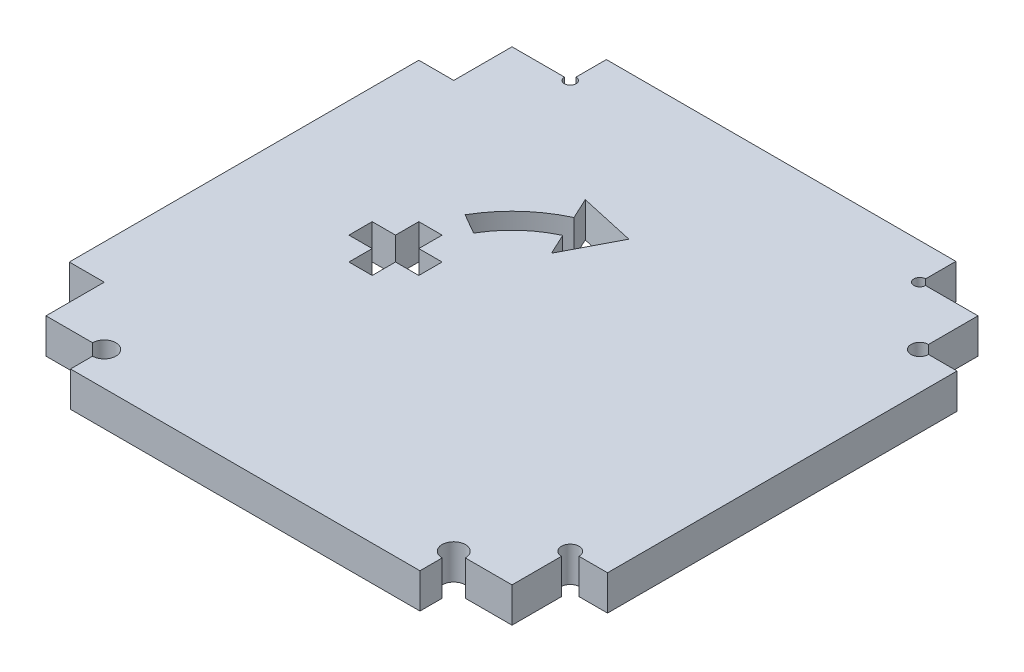
from build123d import *

# Parameters (mm, degrees)
BOSS_EXTRUDE1_DEPTH = 3
SKETCH4_R           = 0.5
SKETCH4_R_2         = 0.75
SKETCH4_R_3         = 1
CUT_EXTRUDE1_DEPTH  = 33.876283245


with BuildPart() as part:
    # Sketch1 → Boss-Extrude1 (new body)
    with BuildSketch(Plane(origin=(0, 0, 0), x_dir=(1, 0, 0), z_dir=(0, 1, 0))):
        Polygon((-20, -20), (-20, -15), (-23, -15), (-23, 15), (-20, 15), (-20, 20), (-15, 20), (-15, 23.1), (15, 23.1), (15, 20), (20, 20), (20, 15), (23.2, 15), (23.2, -15), (20, -15), (20, -20), (15, -20), (15, -22.9), (-15, -22.9), (-15, -20), align=None)
        Polygon((-13, -1), (-11, -1), (-11, -3), (-9, -3), (-9, -1), (-7, -1), (-7, 1), (-9, 1), (-9, 3), (-11, 3), (-11, 1), (-13, 1), align=None, mode=Mode.SUBTRACT)
        with BuildLine():
            Line((-9.526279442, 5.5), (-7.794228634, 4.5))
            ThreePointArc((-7.794228634, 4.5), (-6.080311869, 6.635496031), (-3.803564356, 8.156770083))
            Line((-3.803564356, 8.156770083), (-2.958327832, 6.344154509))
            Line((-2.958327832, 6.344154509), (-0.682812706, 10.715378396))
            Line((-0.682812706, 10.715378396), (-5.494037403, 11.782001231))
            Line((-5.494037403, 11.782001231), (-4.648800879, 9.969385657))
            ThreePointArc((-4.648800879, 9.969385657), (-7.431492284, 8.110050705), (-9.526279442, 5.5))
        make_face(mode=Mode.SUBTRACT)
    extrude(amount=BOSS_EXTRUDE1_DEPTH)

    # Sketch4 → Cut-Extrude1 (cut, through all)
    with BuildSketch(Plane(origin=(0, 3, 0), x_dir=(1, 0, 0), z_dir=(0, 1, 0))):
        with Locations((-15, 20)):
            Circle(SKETCH4_R)
        with Locations((15, 20)):
            Circle(SKETCH4_R)
        with Locations((20, 15)):
            Circle(SKETCH4_R_2)
        with Locations((20, -15)):
            Circle(SKETCH4_R_2)
        with Locations((15, -20)):
            Circle(SKETCH4_R_3)
        with Locations((-15, -20)):
            Circle(SKETCH4_R_3)
    extrude(amount=-CUT_EXTRUDE1_DEPTH, mode=Mode.SUBTRACT)


solid = part.part
